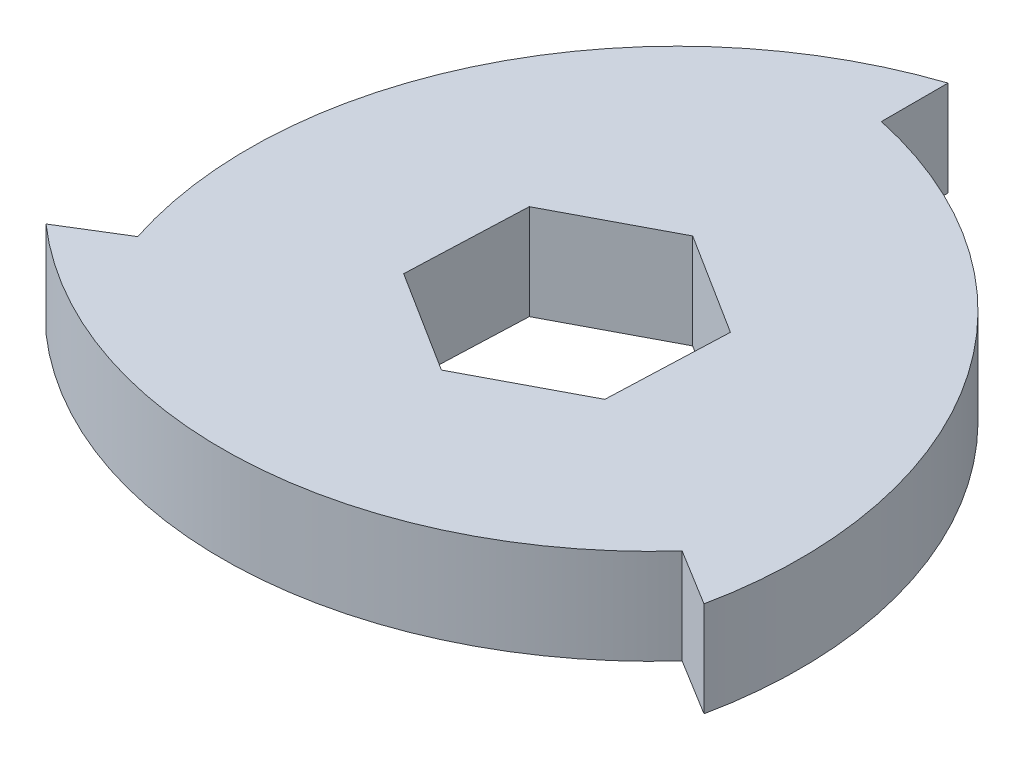
from build123d import *

# Parameters (mm, degrees)
SKETCH1_R           = 40
BOSS_EXTRUDE1_DEPTH = 10
CUT_EXTRUDE1_REACH  = 59.446


with BuildPart() as part:
    # Sketch1 → Boss-Extrude1 (new body)
    with BuildSketch(Plane(origin=(0, 0, 0), x_dir=(1, 0, 0), z_dir=(0, 1, 0))):
        with Locations(Location((0, 0, 0), (0, 0, 270))):
            Circle(SKETCH1_R)
    extrude(amount=BOSS_EXTRUDE1_DEPTH)

    # Sketch2 → Cut-Extrude1 (cut, up to next)
    with BuildSketch(Plane(origin=(0, 10, 0), x_dir=(1, 0, 0), z_dir=(0, 1, 0)), mode=Mode.PRIVATE) as cut_extrude1_sk1:
        Polygon((11.238774325, 5.913221721), (0.497117057, 12.691874424), (-10.744197021, 6.778652704), (-11.243853833, -5.913221721), (-0.502196565, -12.691874424), (10.739117514, -6.778652704), align=None)
    cut_extrude1_tool1 = extrude(cut_extrude1_sk1.sketch, amount=-CUT_EXTRUDE1_REACH, mode=Mode.PRIVATE) & part.part
    # Sketch2 → Cut-Extrude1 (cut, up to next)
    with BuildSketch(Plane(origin=(0, 10, 0), x_dir=(1, 0, 0), z_dir=(0, 1, 0)), mode=Mode.PRIVATE) as cut_extrude1_sk2:
        with BuildLine():
            Line((34.543248704, -20.168390341), (28.580108202, -16.502199491))
            ThreePointArc((28.580108202, -16.502199491), (-2.229161984, -31.290031187), (-34.543248704, -20.168390341))
            ThreePointArc((-34.543248704, -20.168390341), (-19.915626859, -34.689592197), (0, -40))
            ThreePointArc((0, -40), (19.915626859, -34.689592197), (34.543248704, -20.168390341))
        make_face()
    cut_extrude1_tool2 = extrude(cut_extrude1_sk2.sketch, amount=-CUT_EXTRUDE1_REACH, mode=Mode.PRIVATE) & part.part
    # Sketch2 → Cut-Extrude1 (cut, up to next)
    with BuildSketch(Plane(origin=(0, 10, 0), x_dir=(1, 0, 0), z_dir=(0, 1, 0)), mode=Mode.PRIVATE) as cut_extrude1_sk3:
        with BuildLine():
            ThreePointArc((0, 33), (28.225744016, 13.532643941), (34.543248704, -20.168390341))
            ThreePointArc((34.543248704, -20.168390341), (34.689592197, 19.915626859), (0, 40))
            Line((0, 40), (0, 33))
        make_face()
    cut_extrude1_tool3 = extrude(cut_extrude1_sk3.sketch, amount=-CUT_EXTRUDE1_REACH, mode=Mode.PRIVATE) & part.part
    # Sketch2 → Cut-Extrude1 (cut, up to next)
    with BuildSketch(Plane(origin=(0, 10, 0), x_dir=(1, 0, 0), z_dir=(0, 1, 0)), mode=Mode.PRIVATE) as cut_extrude1_sk4:
        with BuildLine():
            ThreePointArc((0, 40), (-34.689592197, 19.915626859), (-34.543248704, -20.168390341))
            Line((-34.543248704, -20.168390341), (-28.580108202, -16.502199491))
            ThreePointArc((-28.580108202, -16.502199491), (-25.909016553, 17.626037907), (0, 40))
        make_face()
    cut_extrude1_tool4 = extrude(cut_extrude1_sk4.sketch, amount=-CUT_EXTRUDE1_REACH, mode=Mode.PRIVATE) & part.part
    add(cut_extrude1_tool1.solids().sort_by_distance((-0.00254, 10, 0))[0], mode=Mode.SUBTRACT)
    add(cut_extrude1_tool2.solids().sort_by_distance((5.104004, 10, 31.071916))[0], mode=Mode.SUBTRACT)
    add(cut_extrude1_tool3.solids().sort_by_distance((24.380546, 10, -19.814078))[0], mode=Mode.SUBTRACT)
    add(cut_extrude1_tool4.solids().sort_by_distance((-29.411799, 10, -11.104167))[0], mode=Mode.SUBTRACT)


solid = part.part
